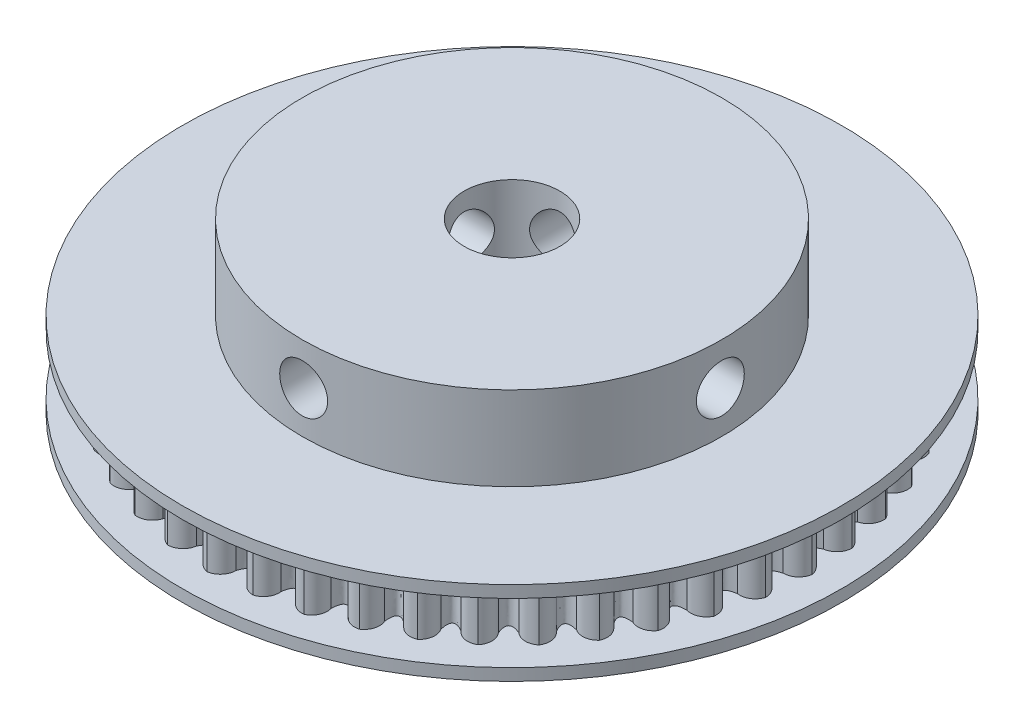
from build123d import *

# Parameters (mm, degrees)
SKETCH1_W           = 20.25
SKETCH1_H           = 5
CUT_EXTRUDE2_DEPTH  = 37.057246151
CIRPATTERN1_COUNT   = 44
SKETCH3_R           = 27.5
BOSS_EXTRUDE1_DEPTH = 1
BOSS_EXTRUDE2_START = 1
SKETCH4_R           = 27.5
BOSS_EXTRUDE2_DEPTH = 1
SKETCH5_R           = 17.5
BOSS_EXTRUDE3_DEPTH = 7
SKETCH6_R           = 4
CUT_EXTRUDE3_DEPTH  = 42.334005504
SKETCH7_R           = 2
CUT_EXTRUDE4_DEPTH  = 42.006097242
CIRPATTERN2_COUNT   = 4


with BuildPart() as part:
    # Sketch1 → Revolve1 (revolve)
    with BuildSketch(Plane.XY, mode=Mode.PRIVATE) as revolve1_sk:
        with Locations((15.125, 2.5)):
            Rectangle(SKETCH1_W, SKETCH1_H)
    revolve(revolve1_sk.sketch.rotate(Axis((0, 0, 0), (0, 1, 0)), 90), axis=Axis((0, 0, 0), (0, 1, 0)))

    # Sketch2 → Cut-Extrude2 (cut, through all)
    with BuildSketch(Plane(origin=(0, 5, 0), x_dir=(1, 0, 0), z_dir=(0, 1, 0))):
        with BuildLine():
            Line((0, 25.25), (0, 27.328621669))
            Line((0, 27.328621669), (4.54326746, 26.833328565))
            Line((4.54326746, 26.833328565), (4, 24.931155208))
            ThreePointArc((4, 24.931155208), (3.023292371, 24.694432086), (2.507218668, 23.832072785))
            add(Edge.make_bspline(
                [(1.299819144, 23.928316048), (1.786126215, 22.407469202), (2.507218668, 23.832072785)],
                knots=[0, 0, 0, 1, 1, 1], degree=2))
            ThreePointArc((1.299819144, 23.928316048), (0.926873545, 24.861540142), (0, 25.25))
        make_face()
    cut_extrude2 = extrude(amount=-CUT_EXTRUDE2_DEPTH, mode=Mode.SUBTRACT)

    # CirPattern1: Cut-Extrude2 ×44 about axis
    cirpattern1_axis = Axis((0, 0, 0), (0, -1, 0))
    for i in range(1, CIRPATTERN1_COUNT):
        add(cut_extrude2.rotate(cirpattern1_axis, i * 360 / CIRPATTERN1_COUNT), mode=Mode.SUBTRACT)

    # Sketch3 → Boss-Extrude1 (add)
    with BuildSketch(Plane(origin=(0, 5, 0), x_dir=(1, 0, 0), z_dir=(0, 1, 0))):
        with Locations(Location((0, 0, 0), (0, 0, 270))):
            Circle(SKETCH3_R)
    extrude(amount=BOSS_EXTRUDE1_DEPTH)

    # Sketch4 → Boss-Extrude2 (add)
    with BuildSketch(Plane.XZ.offset(BOSS_EXTRUDE2_START)):
        with Locations(Location((0, 0, 0), (0, 0, 90))):
            Circle(SKETCH4_R)
    extrude(amount=-BOSS_EXTRUDE2_DEPTH)

    # Sketch5 → Boss-Extrude3 (add)
    with BuildSketch(Plane(origin=(0, 6, 0), x_dir=(1, 0, 0), z_dir=(0, 1, 0))):
        with Locations(Location((0, 0, 0), (0, 0, 270))):
            Circle(SKETCH5_R)
    extrude(amount=BOSS_EXTRUDE3_DEPTH)

    # Sketch6 → Cut-Extrude3 (cut, through all)
    with BuildSketch(Plane(origin=(0, 13, 0), x_dir=(1, 0, 0), z_dir=(0, 1, 0))):
        with Locations(Location((0, 0, 0), (0, 0, 270))):
            Circle(SKETCH6_R)
    extrude(amount=-CUT_EXTRUDE3_DEPTH, mode=Mode.SUBTRACT)

    # Sketch7 → Cut-Extrude4 (cut, through all)
    with BuildSketch(Plane(origin=(0, 0, 0), x_dir=(0, 0, -1), z_dir=(1, 0, 0))):
        with Locations((0, 9.5)):
            Circle(SKETCH7_R)
    cut_extrude4 = extrude(amount=-CUT_EXTRUDE4_DEPTH, mode=Mode.SUBTRACT)

    # CirPattern2: Cut-Extrude4 ×4 about axis
    cirpattern2_axis = Axis((0, 13, 0), (0, -1, 0))
    for i in range(1, CIRPATTERN2_COUNT):
        add(cut_extrude4.rotate(cirpattern2_axis, i * 360 / CIRPATTERN2_COUNT), mode=Mode.SUBTRACT)


solid = part.part
